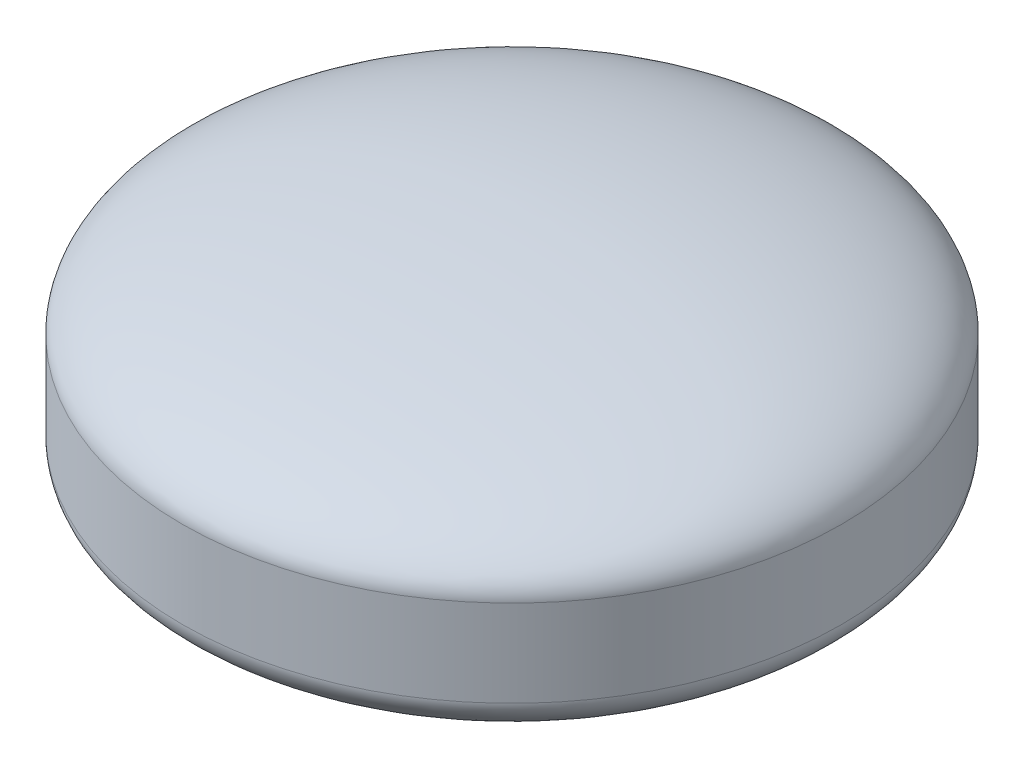
from build123d import *

# Parameters (mm, degrees)
SKETCH_2_W = 9.5
SKETCH_2_H = 1.25


with BuildPart() as part:
    # 스케치2 → 회전3 (revolve)
    with BuildSketch(Plane.XY, mode=Mode.PRIVATE) as revolve_3_sk:
        with Locations((-4.75, 0.625)):
            Rectangle(SKETCH_2_W, SKETCH_2_H)
        with BuildLine():
            Line((-9.5, 1.25), (0, 1.25))
            Line((0, 1.25), (0, 3.75))
            add(Edge.make_bspline(
                [(0, 3.75), (-9.5, 3.75), (-9.5, 1.25)],
                knots=[4.71238898, 4.71238898, 4.71238898, 6.283185307, 6.283185307, 6.283185307], degree=2, weights=[1, 0.707106781, 1]))
        make_face()
    revolve_3 = revolve(revolve_3_sk.sketch.rotate(Axis((0, 0, 0), (0, 1, 0)), 270), axis=Axis((0, 0, 0), (0, 1, 0)))

    # 대칭 복사1: 회전3 across plane
    add(revolve_3.mirror(Plane.ZX))


solid = part.part
